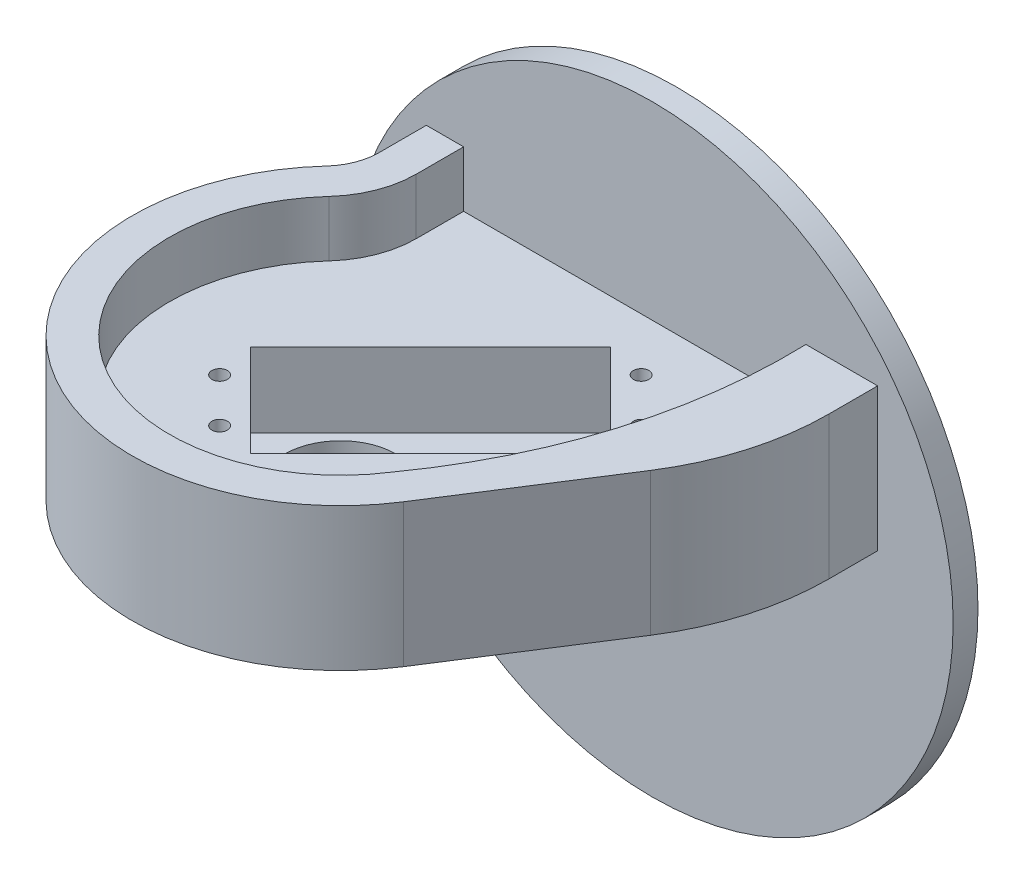
from build123d import *

# Parameters (mm, degrees)
SKETCH1_R                       = 48.5
SKETCH1_R_2                     = 1.5
BOSS_EXTRUDE1_DEPTH             = 4
SKETCH2_R                       = 3.75
CUT_EXTRUDE1_DEPTH              = 1.5
BOSS_EXTRUDE2_START             = 4
SKETCH3_R                       = 9
BOSS_EXTRUDE2_DEPTH             = 14
CUT_EXTRUDE2_START              = 6
SKETCH4_R                       = 1.25
CUT_EXTRUDE2_DEPTH              = 91.444646155
BOSS_EXTRUDE3_DEPTH             = 9
BOSS_EXTRUDE3_DIRECTION_2_REACH = 108.638


with BuildPart() as part:
    # Sketch1 → Boss-Extrude1 (new body)
    with BuildSketch(Plane(origin=(0, 0, 0), x_dir=(0, 1, 0), z_dir=(0, 0, 1))):
        with Locations(Location((0, 0, 0), (0, 0, 270))):
            Circle(SKETCH1_R)
        with Locations(Location((0, 7.25, 0), (0, 0, 270))):
            Circle(SKETCH1_R_2, mode=Mode.SUBTRACT)
        with Locations(Location((0, -7.25, 0), (0, 0, 270))):
            Circle(SKETCH1_R_2, mode=Mode.SUBTRACT)
    extrude(amount=BOSS_EXTRUDE1_DEPTH)

    # Sketch2 → Cut-Extrude1 (cut)
    with BuildSketch(Plane.XY.offset(4)):
        Circle(SKETCH2_R)
    extrude(amount=-CUT_EXTRUDE1_DEPTH, mode=Mode.SUBTRACT)

    # Sketch3 → Boss-Extrude2 (add)
    with BuildSketch(Plane(origin=(0, 0, 0), x_dir=(-1, 0, 0), z_dir=(0, 1, 0)).offset(BOSS_EXTRUDE2_START)):
        with BuildLine():
            Line((-30.34, 4), (-30.34, 11.86))
            ThreePointArc((-30.34, 11.86), (-28.924736696, 21.745164753), (-24.792654999, 30.836113728))
            Line((-24.792654999, 30.836113728), (-9.278105641, 55.104149989))
            ThreePointArc((-9.278105641, 55.104149989), (30.651097233, 62.12443475), (34.252718415, 21.743078098))
            ThreePointArc((34.252718415, 21.743078098), (31.352340729, 17.057138369), (30.34, 11.64))
            Line((30.34, 11.64), (30.34, 4))
            Line((30.34, 4), (-30.34, 4))
        make_face()
        with Locations(Location((13.91, 40.28, 0), (0, 0, 90))):
            Circle(SKETCH3_R, mode=Mode.SUBTRACT)
    extrude(amount=BOSS_EXTRUDE2_DEPTH)

    # Sketch4 → Cut-Extrude2 (cut, through all)
    with BuildSketch(Plane(origin=(0, 0, 0), x_dir=(-1, 0, 0), z_dir=(0, 1, 0)).offset(CUT_EXTRUDE2_START)):
        with Locations(Location((20.096096654, 53.537164466, 0), (0, 0, 270))):
            Circle(SKETCH4_R)
        with Locations(Location((27.167164466, 46.466096654, 0), (0, 0, 270))):
            Circle(SKETCH4_R)
        with Locations(Location((-6.773961031, 12.524971157, 0), (0, 0, 270))):
            Circle(SKETCH4_R)
        with Locations(Location((-13.845028843, 19.596038969, 0), (0, 0, 270))):
            Circle(SKETCH4_R)
        Polygon((-0.41, 11.110757595), (28.581378029, 40.102135624), (13.732135624, 54.951378029), (-15.259242405, 25.96), align=None)
    extrude(amount=CUT_EXTRUDE2_DEPTH, mode=Mode.SUBTRACT)

    # Sketch5 → Boss-Extrude3 (add)
    with BuildSketch(Plane(origin=(0, 18, 0), x_dir=(-1, 0, 0), z_dir=(0, 1, 0))):
        with BuildLine():
            Line((36.34, 4), (36.34, 11.64))
            ThreePointArc((36.34, 11.64), (36.947404437, 14.890283021), (38.687631049, 17.701846859))
            ThreePointArc((38.687631049, 17.701846859), (34.300821036, 66.886736311), (-14.333340667, 58.335960445))
            Line((-14.333340667, 58.335960445), (-29.847890025, 34.067924184))
            ThreePointArc((-29.847890025, 34.067924184), (-34.683704058, 23.428701186), (-36.34, 11.86))
            Line((-36.34, 11.86), (-36.34, 4))
            Line((-36.34, 4), (-33.34, 4))
            Line((-33.34, 4), (-30.34, 4))
            Line((-30.34, 4), (-24.79, 4))
            ThreePointArc((-24.79, 4), (-21.256686804, 30.833791886), (-9.278105641, 55.104149989))
            ThreePointArc((-9.278105641, 55.104149989), (30.651097233, 62.12443475), (34.252718415, 21.743078098))
            ThreePointArc((34.252718415, 21.743078098), (31.352340729, 17.057138369), (30.34, 11.64))
            Line((30.34, 11.64), (30.34, 4))
            Line((30.34, 4), (33.34, 4))
            Line((33.34, 4), (36.34, 4))
        make_face()
    extrude(amount=BOSS_EXTRUDE3_DEPTH)

    # Boss-Extrude3 direction 2: up to this face of the body (flat: up to its plane)
    boss_extrude3_direction_2_end = Plane(part.part.faces().sort_by_distance((-6.762869766, 4, 32.000889593))[0])
    # Sketch5 → Boss-Extrude3 direction 2 (add, up to the picked face)
    with BuildSketch(Plane(origin=(0, 18, 0), x_dir=(-1, 0, 0), z_dir=(0, 1, 0)), mode=Mode.PRIVATE) as boss_extrude3_direction_2_sk1:
        with BuildLine():
            Line((36.34, 4), (36.34, 11.64))
            ThreePointArc((36.34, 11.64), (36.947404437, 14.890283021), (38.687631049, 17.701846859))
            ThreePointArc((38.687631049, 17.701846859), (34.300821036, 66.886736311), (-14.333340667, 58.335960445))
            Line((-14.333340667, 58.335960445), (-29.847890025, 34.067924184))
            ThreePointArc((-29.847890025, 34.067924184), (-34.683704058, 23.428701186), (-36.34, 11.86))
            Line((-36.34, 11.86), (-36.34, 4))
            Line((-36.34, 4), (-33.34, 4))
            Line((-33.34, 4), (-30.34, 4))
            Line((-30.34, 4), (-24.79, 4))
            ThreePointArc((-24.79, 4), (-21.256686804, 30.833791886), (-9.278105641, 55.104149989))
            ThreePointArc((-9.278105641, 55.104149989), (30.651097233, 62.12443475), (34.252718415, 21.743078098))
            ThreePointArc((34.252718415, 21.743078098), (31.352340729, 17.057138369), (30.34, 11.64))
            Line((30.34, 11.64), (30.34, 4))
            Line((30.34, 4), (33.34, 4))
            Line((33.34, 4), (36.34, 4))
        make_face()
    boss_extrude3_direction_2_tool1 = split(extrude(boss_extrude3_direction_2_sk1.sketch, amount=-BOSS_EXTRUDE3_DIRECTION_2_REACH, mode=Mode.PRIVATE), bisect_by=boss_extrude3_direction_2_end, keep=Keep.BOTH, mode=Mode.PRIVATE)
    add(boss_extrude3_direction_2_tool1.solids().sort_by(Axis((-35.249588, 18, 7.82), (0, -1, 0)))[0])


solid = part.part
